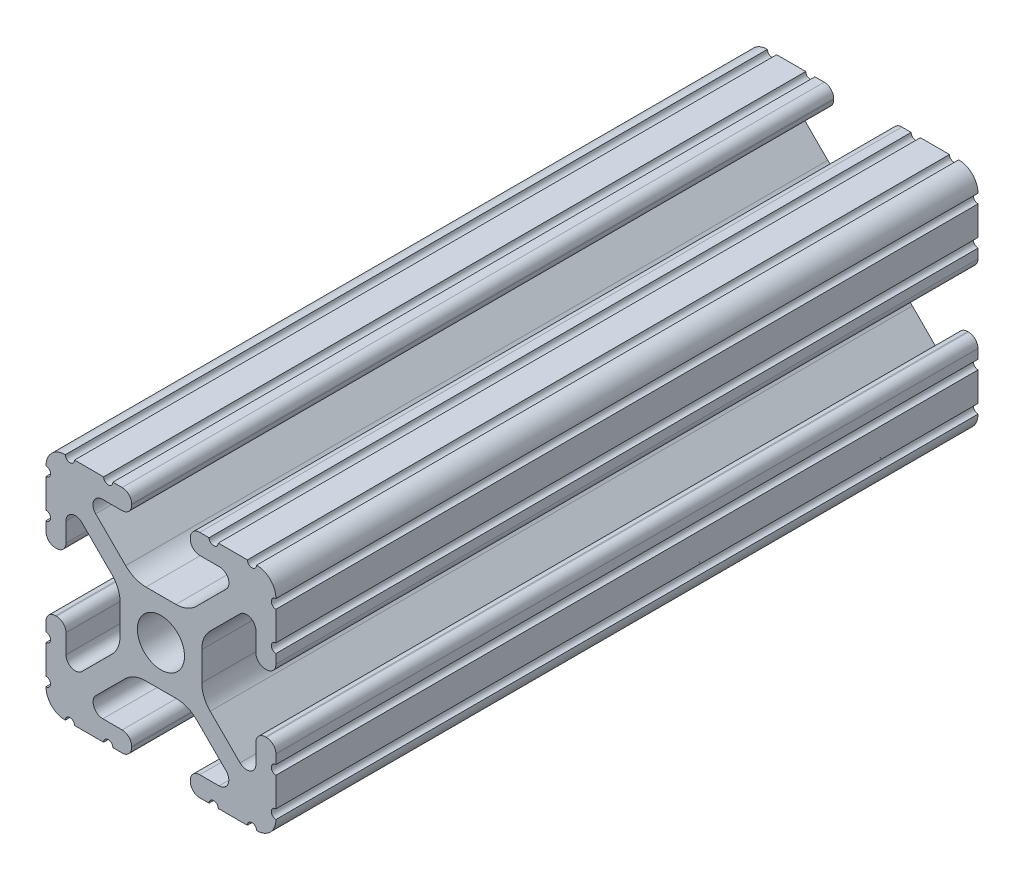
from build123d import *

# Parameters (mm, degrees)
SKETCH1_R           = 2.6035
BOSS_EXTRUDE1_DEPTH = 38.7858


with BuildPart() as part:
    # Sketch1 → Boss-Extrude1 (new, symmetric)
    with BuildSketch(Plane.XY):
        with BuildLine():
            Line((-7.179650497, -8.645192506), (-3.952270251, -5.423690499))
            ThreePointArc((-3.952270251, -5.423690499), (-2.922936451, -4.736929036), (-1.709253557, -4.4958))
            Line((-1.709253557, -4.4958), (1.709253557, -4.4958))
            ThreePointArc((1.709253557, -4.4958), (2.922936451, -4.736929036), (3.952270251, -5.423690499))
            Line((3.952270251, -5.423690499), (7.179650497, -8.645192506))
            ThreePointArc((7.179650497, -8.645192506), (7.41473083, -9.822813117), (6.416408329, -10.4902))
            Line((6.416408329, -10.4902), (4.287512407, -10.4902))
            ThreePointArc((4.287512407, -10.4902), (3.54574862, -10.79744862), (3.2385, -11.539212407))
            Line((3.2385, -11.539212407), (3.2385, -11.650987593))
            ThreePointArc((3.2385, -11.650987593), (3.54574862, -12.39275138), (4.287512407, -12.7))
            Line((4.287512407, -12.7), (5.317126718, -12.7))
            ThreePointArc((5.317126718, -12.7), (5.825126718, -12.192), (6.333126718, -12.7))
            Line((6.333126718, -12.7), (9.550443118, -12.7))
            ThreePointArc((9.550443118, -12.7), (10.058366869, -12.192000006), (10.566443095, -12.699847501))
            ThreePointArc((10.566443095, -12.699847501), (12.082537762, -12.08250727), (12.699846982, -10.566399977))
            ThreePointArc((12.699846982, -10.566399977), (12.192000006, -10.058323491), (12.7, -9.5504))
            Line((12.7, -9.5504), (12.7, -6.3330836))
            ThreePointArc((12.7, -6.3330836), (12.192, -5.8250836), (12.7, -5.3170836))
            Line((12.7, -5.3170836), (12.7, -4.287469289))
            ThreePointArc((12.7, -4.287469289), (12.39275138, -3.545705502), (11.650987593, -3.238456882))
            Line((11.650987593, -3.238456882), (11.539212407, -3.238456882))
            ThreePointArc((11.539212407, -3.238456882), (10.79744862, -3.545705502), (10.4902, -4.287469289))
            Line((10.4902, -4.287469289), (10.4902, -6.402089023))
            ThreePointArc((10.4902, -6.402089023), (9.856505071, -7.351067942), (8.737131347, -7.129408934))
            Line((8.737131347, -7.129408934), (5.441005833, -3.840816462))
            ThreePointArc((5.441005833, -3.840816462), (4.750877967, -2.809883091), (4.5085, -1.593185507))
            Line((4.5085, -1.593185507), (4.5085, 1.593185507))
            ThreePointArc((4.5085, 1.593185507), (4.750877967, 2.809883091), (5.441005833, 3.840816462))
            Line((5.441005833, 3.840816462), (8.737131347, 7.129408934))
            ThreePointArc((8.737131347, 7.129408934), (9.856505071, 7.351067942), (10.4902, 6.402089023))
            Line((10.4902, 6.402089023), (10.4902, 4.287469289))
            ThreePointArc((10.4902, 4.287469289), (10.79744862, 3.545705502), (11.539212407, 3.238456882))
            Line((11.539212407, 3.238456882), (11.650987593, 3.238456882))
            ThreePointArc((11.650987593, 3.238456882), (12.39275138, 3.545705502), (12.7, 4.287469289))
            Line((12.7, 4.287469289), (12.7, 5.3170836))
            ThreePointArc((12.7, 5.3170836), (12.192, 5.8250836), (12.7, 6.3330836))
            Line((12.7, 6.3330836), (12.7, 9.5504))
            ThreePointArc((12.7, 9.5504), (12.192000006, 10.058323491), (12.699846982, 10.566399977))
            ThreePointArc((12.699846982, 10.566399977), (12.082537762, 12.08250727), (10.566443095, 12.699847501))
            ThreePointArc((10.566443095, 12.699847501), (10.058366869, 12.192000006), (9.550443118, 12.7))
            Line((9.550443118, 12.7), (6.333126718, 12.7))
            ThreePointArc((6.333126718, 12.7), (5.825126718, 12.192), (5.317126718, 12.7))
            Line((5.317126718, 12.7), (4.287512407, 12.7))
            ThreePointArc((4.287512407, 12.7), (3.54574862, 12.39275138), (3.2385, 11.650987593))
            Line((3.2385, 11.650987593), (3.2385, 11.539212407))
            ThreePointArc((3.2385, 11.539212407), (3.54574862, 10.79744862), (4.287512407, 10.4902))
            Line((4.287512407, 10.4902), (6.476788598, 10.4902))
            ThreePointArc((6.476788598, 10.4902), (7.432222385, 9.85140422), (7.207036008, 8.724370562))
            Line((7.207036008, 8.724370562), (3.898272566, 5.423169045))
            ThreePointArc((3.898272566, 5.423169045), (2.869120213, 4.736787962), (1.655778399, 4.4958))
            Line((1.655778399, 4.4958), (-1.655778399, 4.4958))
            ThreePointArc((-1.655778399, 4.4958), (-2.869120213, 4.736787962), (-3.898272566, 5.423169045))
            Line((-3.898272566, 5.423169045), (-7.207036008, 8.724370562))
            ThreePointArc((-7.207036008, 8.724370562), (-7.432222385, 9.85140422), (-6.476788598, 10.4902))
            Line((-6.476788598, 10.4902), (-4.287512407, 10.4902))
            ThreePointArc((-4.287512407, 10.4902), (-3.54574862, 10.79744862), (-3.2385, 11.539212407))
            Line((-3.2385, 11.539212407), (-3.2385, 11.650987593))
            ThreePointArc((-3.2385, 11.650987593), (-3.54574862, 12.39275138), (-4.287512407, 12.7))
            Line((-4.287512407, 12.7), (-5.317126718, 12.7))
            ThreePointArc((-5.317126718, 12.7), (-5.825126718, 12.192), (-6.333126718, 12.7))
            Line((-6.333126718, 12.7), (-9.550443118, 12.7))
            ThreePointArc((-9.550443118, 12.7), (-10.058366869, 12.192000006), (-10.566443095, 12.699847501))
            ThreePointArc((-10.566443095, 12.699847501), (-12.082537762, 12.08250727), (-12.699846982, 10.566399977))
            ThreePointArc((-12.699846982, 10.566399977), (-12.192000006, 10.058323491), (-12.7, 9.5504))
            Line((-12.7, 9.5504), (-12.7, 6.3330836))
            ThreePointArc((-12.7, 6.3330836), (-12.192, 5.8250836), (-12.7, 5.3170836))
            Line((-12.7, 5.3170836), (-12.7, 4.287469289))
            ThreePointArc((-12.7, 4.287469289), (-12.39275138, 3.545705502), (-11.650987593, 3.238456882))
            Line((-11.650987593, 3.238456882), (-11.539212407, 3.238456882))
            ThreePointArc((-11.539212407, 3.238456882), (-10.79744862, 3.545705502), (-10.4902, 4.287469289))
            Line((-10.4902, 4.287469289), (-10.4902, 6.402089023))
            ThreePointArc((-10.4902, 6.402089023), (-9.856505071, 7.351067942), (-8.737131347, 7.129408934))
            Line((-8.737131347, 7.129408934), (-5.441005833, 3.840816462))
            ThreePointArc((-5.441005833, 3.840816462), (-4.750877967, 2.809883091), (-4.5085, 1.593185507))
            Line((-4.5085, 1.593185507), (-4.5085, -1.593185507))
            ThreePointArc((-4.5085, -1.593185507), (-4.750877967, -2.809883091), (-5.441005833, -3.840816462))
            Line((-5.441005833, -3.840816462), (-8.737131347, -7.129408934))
            ThreePointArc((-8.737131347, -7.129408934), (-9.856505071, -7.351067942), (-10.4902, -6.402089023))
            Line((-10.4902, -6.402089023), (-10.4902, -4.287469289))
            ThreePointArc((-10.4902, -4.287469289), (-10.79744862, -3.545705502), (-11.539212407, -3.238456882))
            Line((-11.539212407, -3.238456882), (-11.650987593, -3.238456882))
            ThreePointArc((-11.650987593, -3.238456882), (-12.39275138, -3.545705502), (-12.7, -4.287469289))
            Line((-12.7, -4.287469289), (-12.7, -5.3170836))
            ThreePointArc((-12.7, -5.3170836), (-12.192, -5.8250836), (-12.7, -6.3330836))
            Line((-12.7, -6.3330836), (-12.7, -9.5504))
            ThreePointArc((-12.7, -9.5504), (-12.192000006, -10.058323491), (-12.699846982, -10.566399977))
            ThreePointArc((-12.699846982, -10.566399977), (-12.082537762, -12.08250727), (-10.566443095, -12.699847501))
            ThreePointArc((-10.566443095, -12.699847501), (-10.058366869, -12.192000006), (-9.550443118, -12.7))
            Line((-9.550443118, -12.7), (-6.333126718, -12.7))
            ThreePointArc((-6.333126718, -12.7), (-5.825126718, -12.192), (-5.317126718, -12.7))
            Line((-5.317126718, -12.7), (-4.287512407, -12.7))
            ThreePointArc((-4.287512407, -12.7), (-3.54574862, -12.39275138), (-3.2385, -11.650987593))
            Line((-3.2385, -11.650987593), (-3.2385, -11.539212407))
            ThreePointArc((-3.2385, -11.539212407), (-3.54574862, -10.79744862), (-4.287512407, -10.4902))
            Line((-4.287512407, -10.4902), (-6.416408329, -10.4902))
            ThreePointArc((-6.416408329, -10.4902), (-7.41473083, -9.822813117), (-7.179650497, -8.645192506))
        make_face()
        Circle(SKETCH1_R, mode=Mode.SUBTRACT)
    extrude(amount=BOSS_EXTRUDE1_DEPTH, both=True)


solid = part.part
